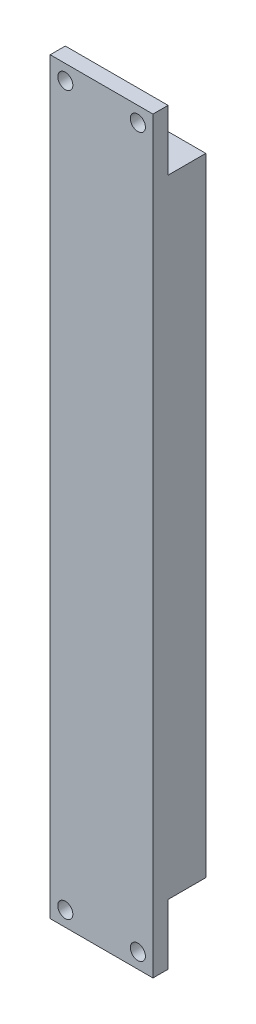
from build123d import *

# Parameters (mm, degrees)
SKETCH1_W           = 21.59
SKETCH1_H           = 157.1752
BOSS_EXTRUDE1_DEPTH = 3.175
SKETCH2_W           = 21.59
SKETCH2_H           = 131.7752
BOSS_EXTRUDE2_DEPTH = 7.9248
SKETCH3_R           = 1.5875
CUT_EXTRUDE1_DEPTH  = 4.7752


with BuildPart() as part:
    # Sketch1 → Boss-Extrude1 (new body)
    with BuildSketch(Plane.XY):
        Rectangle(SKETCH1_W, SKETCH1_H)
    extrude(amount=BOSS_EXTRUDE1_DEPTH)

    # Sketch2 → Boss-Extrude2 (add)
    with BuildSketch(Plane(origin=(0, 0, 0), x_dir=(-1, 0, 0), z_dir=(0, 0, -1))):
        Rectangle(SKETCH2_W, SKETCH2_H)
    extrude(amount=BOSS_EXTRUDE2_DEPTH)

    # Sketch3 → Cut-Extrude1 (cut)
    with BuildSketch(Plane.XY.offset(3.175)):
        with Locations((-7.62, 75.4126)):
            Circle(SKETCH3_R)
        with Locations((7.62, 75.4126)):
            Circle(SKETCH3_R)
        with Locations((7.62, -75.4126)):
            Circle(SKETCH3_R)
        with Locations((-7.62, -75.4126)):
            Circle(SKETCH3_R)
    extrude(amount=-CUT_EXTRUDE1_DEPTH, mode=Mode.SUBTRACT)


solid = part.part
